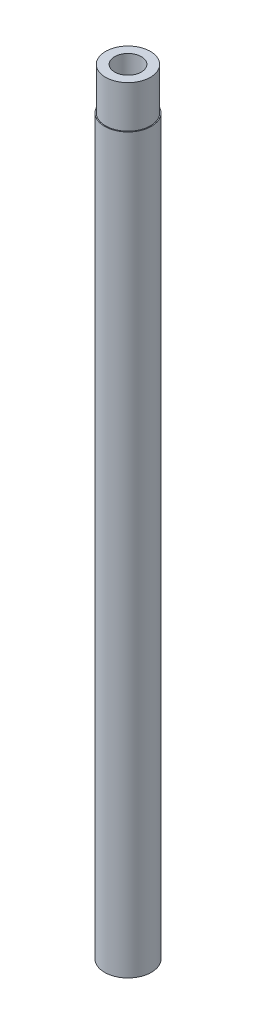
from build123d import *

# Parameters (mm, degrees)
SKETCH1_R           = 11.1125
SKETCH1_R_2         = 6.35
BOSS_EXTRUDE1_DEPTH = 368.3
CUT_EXTRUDE1_START  = -20
SKETCH2_R           = 11.1125
SKETCH2_R_2         = 10.668
CUT_EXTRUDE1_DEPTH  = 20
SKETCH3_R           = 7.14375
SKETCH3_R_2         = 6.35
CUT_EXTRUDE2_DEPTH  = 12.7


with BuildPart() as part:
    # Sketch1 → Boss-Extrude1 (new body)
    with BuildSketch(Plane(origin=(0, 0, 0), x_dir=(1, 0, 0), z_dir=(0, 1, 0))):
        with Locations(Location((0, 0, 0), (0, 0, 270))):
            Circle(SKETCH1_R)
        with Locations(Location((0, 0, 0), (0, 0, 270))):
            Circle(SKETCH1_R_2, mode=Mode.SUBTRACT)
    extrude(amount=BOSS_EXTRUDE1_DEPTH)

    # Sketch2 → Cut-Extrude1 (cut)
    with BuildSketch(Plane(origin=(0, 368.3, 0), x_dir=(1, 0, 0), z_dir=(0, 1, 0)).offset(CUT_EXTRUDE1_START)):
        with Locations(Location((0, 0, 0), (0, 0, 270))):
            Circle(SKETCH2_R)
        with Locations(Location((0, 0, 0), (0, 0, 270))):
            Circle(SKETCH2_R_2, mode=Mode.SUBTRACT)
    extrude(amount=CUT_EXTRUDE1_DEPTH, mode=Mode.SUBTRACT)

    # Sketch3 → Cut-Extrude2 (cut)
    with BuildSketch(Plane.XZ):
        with Locations(Location((0, 0, 0), (0, 0, 270))):
            Circle(SKETCH3_R)
        with Locations(Location((0, 0, 0), (0, 0, 270))):
            Circle(SKETCH3_R_2, mode=Mode.SUBTRACT)
    extrude(amount=-CUT_EXTRUDE2_DEPTH, mode=Mode.SUBTRACT)


solid = part.part
